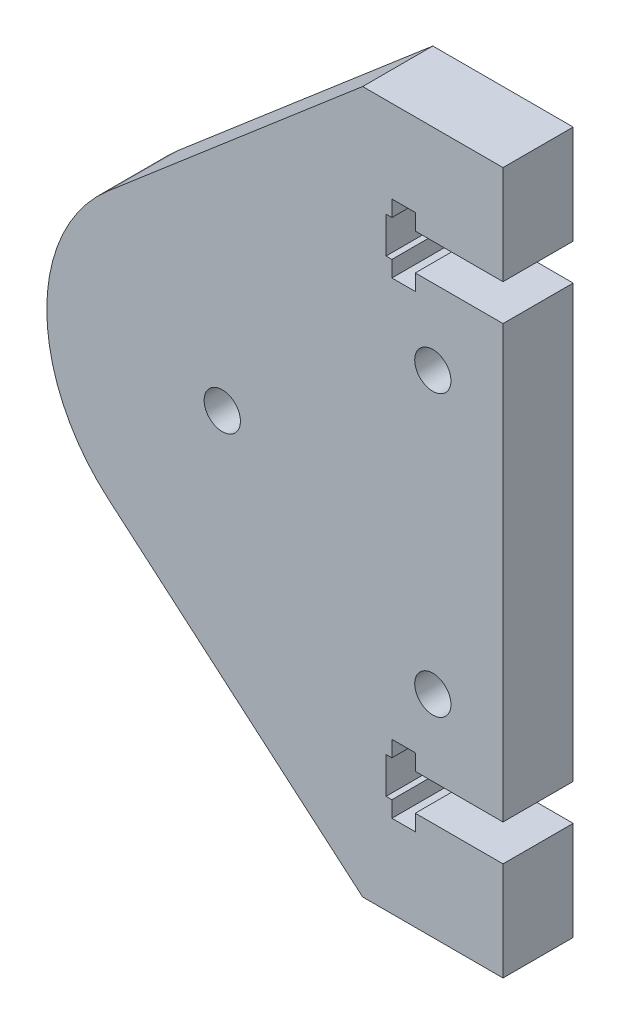
from build123d import *

# Parameters (mm, degrees)
DODANIE_WYCI_GNI_CIE1_DEPTH = 6
SZKIC2_R                    = 1.55
WYTNIJ_WYCI_GNI_CIE1_DEPTH  = 6
WYTNIJ_WYCI_GNI_CIE2_DEPTH  = 6
SZYK_LINIOWY1_COUNT         = 2
SZYK_LINIOWY1_PITCH         = 40
SZKIC4_R                    = 1.55
WYTNIJ_WYCI_GNI_CIE3_DEPTH  = 6


with BuildPart() as part:
    # Szkic1 → Dodanie-wyciągnięcie1 (new body)
    with BuildSketch(Plane.XY):
        with BuildLine():
            Line((-455.064585695, -113.955768861), (-476.813799507, -95.355454386))
            ThreePointArc((-476.813799507, -95.355454386), (-482.064585695, -83.955768861), (-476.813799507, -72.556083337))
            Line((-476.813799507, -72.556083337), (-455.064585695, -53.955768861))
            Line((-455.064585695, -53.955768861), (-443.064585695, -53.955768861))
            Line((-443.064585695, -53.955768861), (-443.064585695, -113.955768861))
            Line((-443.064585695, -113.955768861), (-455.064585695, -113.955768861))
        make_face()
    extrude(amount=DODANIE_WYCI_GNI_CIE1_DEPTH)

    # Szkic2 → Wytnij-wyciągnięcie1 (cut)
    with BuildSketch(Plane.XY.offset(6)):
        with Locations((-467.064585695, -83.955768861)):
            Circle(SZKIC2_R)
    extrude(amount=-WYTNIJ_WYCI_GNI_CIE1_DEPTH, mode=Mode.SUBTRACT)

    # Szkic3 → Wytnij-wyciągnięcie2 (cut)
    with BuildSketch(Plane(origin=(0, 0, 0), x_dir=(-1, 0, 0), z_dir=(0, 0, -1))):
        Polygon((443.064585695, -105.505768861), (450.564585695, -105.505768861), (450.564585695, -106.880768861), (452.564585695, -106.880768861), (452.564585695, -105.505768861), (453.064585695, -105.505768861), (453.064585695, -102.405768861), (452.564585695, -102.405768861), (452.564585695, -101.030768861), (450.564585695, -101.030768861), (450.564585695, -102.405768861), (443.064585695, -102.405768861), align=None)
    wytnij_wyci_gni_cie2 = extrude(amount=-WYTNIJ_WYCI_GNI_CIE2_DEPTH, mode=Mode.SUBTRACT)

    # Szyk liniowy1: Wytnij-wyciągnięcie2 ×2
    with Locations(*[(0, i * SZYK_LINIOWY1_PITCH, 0) for i in range(1, SZYK_LINIOWY1_COUNT)]):
        add(wytnij_wyci_gni_cie2, mode=Mode.SUBTRACT)

    # Szkic4 → Wytnij-wyciągnięcie3 (cut)
    with BuildSketch(Plane(origin=(0, 0, 0), x_dir=(-1, 0, 0), z_dir=(0, 0, -1))):
        with Locations((449.064585017, -95.936775964)):
            Circle(SZKIC4_R)
        with Locations((449.064585017, -71.970769345)):
            Circle(SZKIC4_R)
    extrude(amount=-WYTNIJ_WYCI_GNI_CIE3_DEPTH, mode=Mode.SUBTRACT)


solid = part.part
